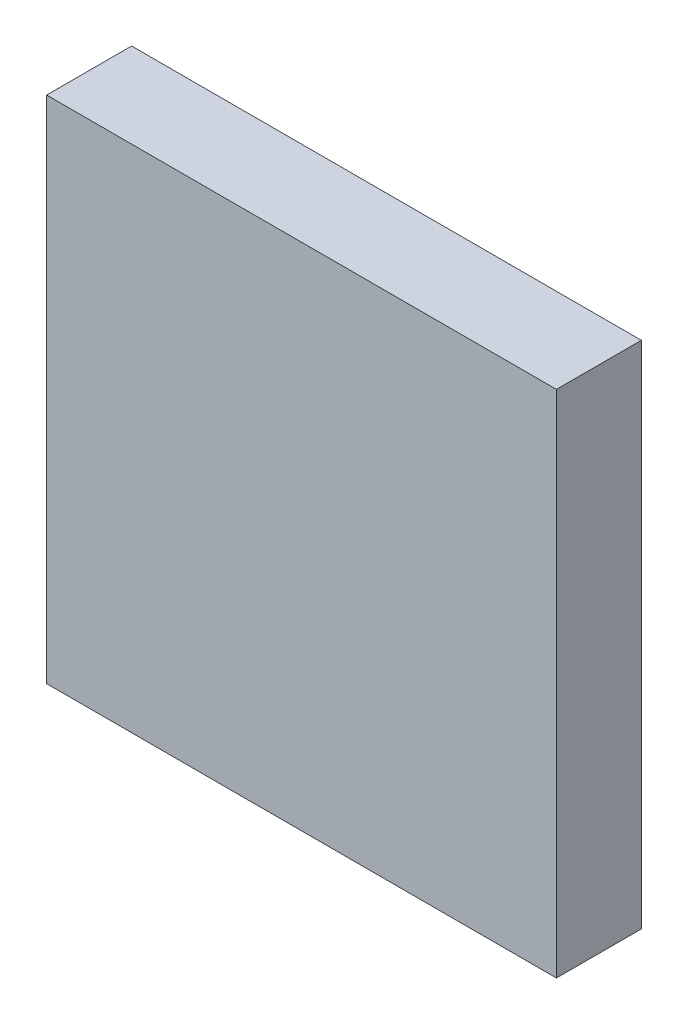
from build123d import *

# Parameters (mm, degrees)
SKETCH1_W           = 15
SKETCH1_H           = 15
BOSS_EXTRUDE1_DEPTH = 2.5


with BuildPart() as part:
    # Sketch1 → Boss-Extrude1 (new body)
    with BuildSketch(Plane.XY):
        Rectangle(SKETCH1_W, SKETCH1_H)
    extrude(amount=BOSS_EXTRUDE1_DEPTH)


solid = part.part
